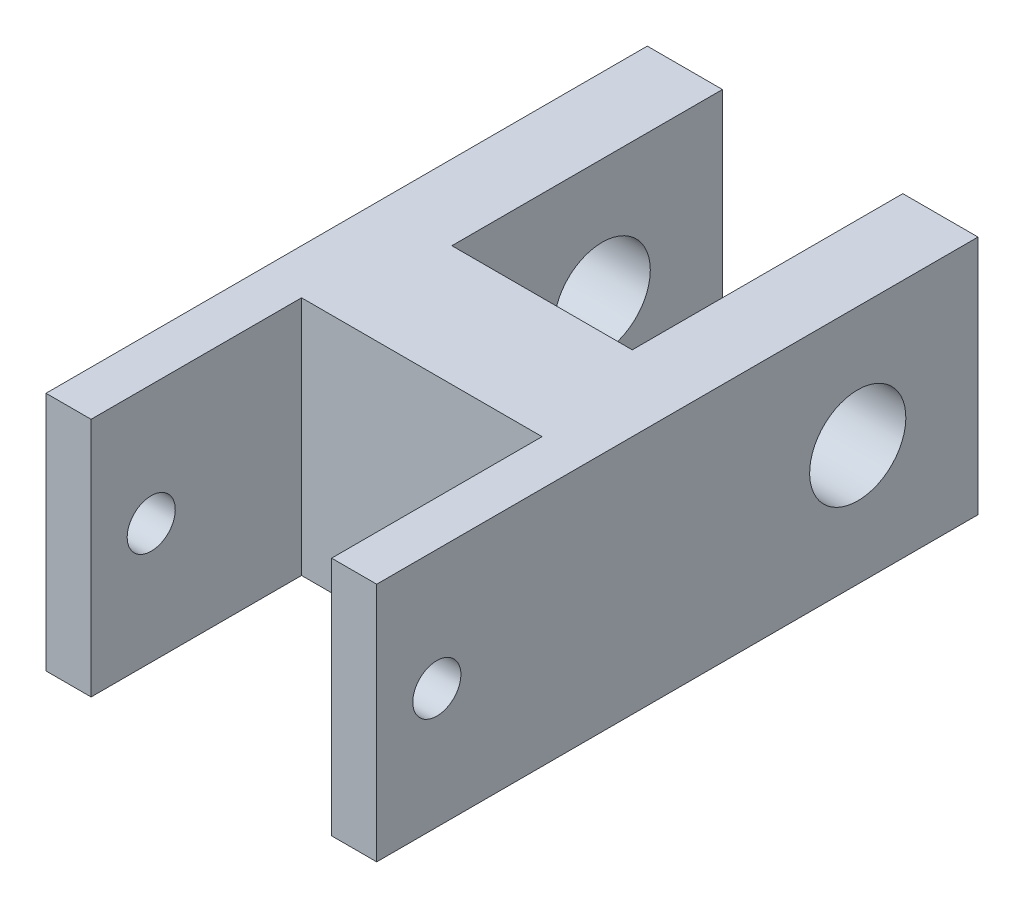
from build123d import *

# Parameters (mm, degrees)
SKETCH1_W           = 55
SKETCH1_H           = 40
BOSS_EXTRUDE1_DEPTH = 100
SKETCH2_W           = 40
SKETCH2_H           = 40
CUT_EXTRUDE1_DEPTH  = 35
SKETCH3_R           = 4
SKETCH3_R_2         = 8
CUT_EXTRUDE2_DEPTH  = 121.933866224
SKETCH4_W           = 30
SKETCH4_H           = 40
CUT_EXTRUDE3_DEPTH  = 45


with BuildPart() as part:
    # Sketch1 → Boss-Extrude1 (new body)
    with BuildSketch(Plane.XY):
        with Locations((27.5, 20)):
            Rectangle(SKETCH1_W, SKETCH1_H)
    extrude(amount=BOSS_EXTRUDE1_DEPTH)

    # Sketch2 → Cut-Extrude1 (cut)
    with BuildSketch(Plane.XY.offset(100)):
        with Locations((27.5, 20)):
            Rectangle(SKETCH2_W, SKETCH2_H)
    extrude(amount=-CUT_EXTRUDE1_DEPTH, mode=Mode.SUBTRACT)

    # Sketch3 → Cut-Extrude2 (cut, through all)
    with BuildSketch(Plane(origin=(55, 0, 0), x_dir=(0, 0, -1), z_dir=(1, 0, 0))):
        with Locations(Location((-90, 20, 0), (0, 0, 90))):
            Circle(SKETCH3_R)
        with Locations(Location((-20, 20, 0), (0, 0, 90))):
            Circle(SKETCH3_R_2)
    extrude(amount=-CUT_EXTRUDE2_DEPTH, mode=Mode.SUBTRACT)

    # Sketch4 → Cut-Extrude3 (cut)
    with BuildSketch(Plane(origin=(0, 0, 0), x_dir=(-1, 0, 0), z_dir=(0, 0, -1))):
        with Locations((-27.5, 20)):
            Rectangle(SKETCH4_W, SKETCH4_H)
    extrude(amount=-CUT_EXTRUDE3_DEPTH, mode=Mode.SUBTRACT)


solid = part.part
